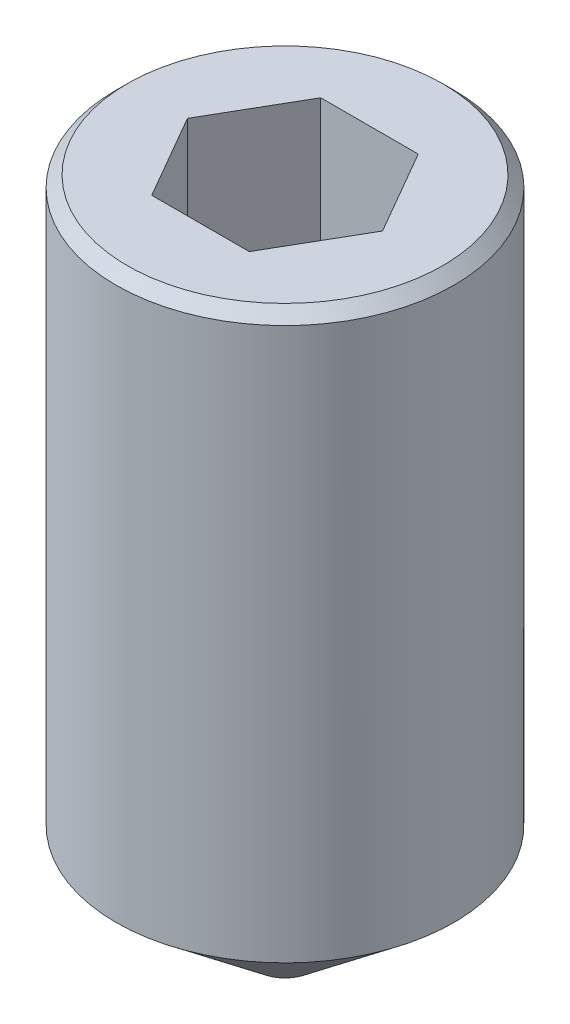
from build123d import *

# Parameters (mm, degrees)
CUT_EXTRUDE_1_DEPTH = 1.5
CHAMFER_1_SIZE      = 0.1


with BuildPart() as part:
    # 草图1 → 旋转1 (revolve)
    with BuildSketch(Plane.XY, mode=Mode.PRIVATE) as revolve_1_sk:
        Polygon((0, 0), (1.5, 0), (1.5, -5), (0.25, -6), (0, -6), align=None)
    revolve(revolve_1_sk.sketch.rotate(Axis((0, 8.713500289, 0), (0, -1, 0)), 90), axis=Axis((0, 8.713500289, 0), (0, -1, 0)))

    # 草图2 → 切除-拉伸1 (cut)
    with BuildSketch(Plane(origin=(0, 0, 0), x_dir=(1, 0, 0), z_dir=(0, 1, 0))):
        Polygon((-0.433012702, -0.75), (0.433012702, -0.75), (0.866025404, 0), (0.433012702, 0.75), (-0.433012702, 0.75), (-0.866025404, 0), align=None)
    extrude(amount=-CUT_EXTRUDE_1_DEPTH, mode=Mode.SUBTRACT)

    # 倒角1
    chamfer_1_edges = [part.edges().sort_by_distance(p)[0] for p in [
        (0, 0, -1.5),
    ]]
    chamfer(chamfer_1_edges, length=CHAMFER_1_SIZE)


solid = part.part
